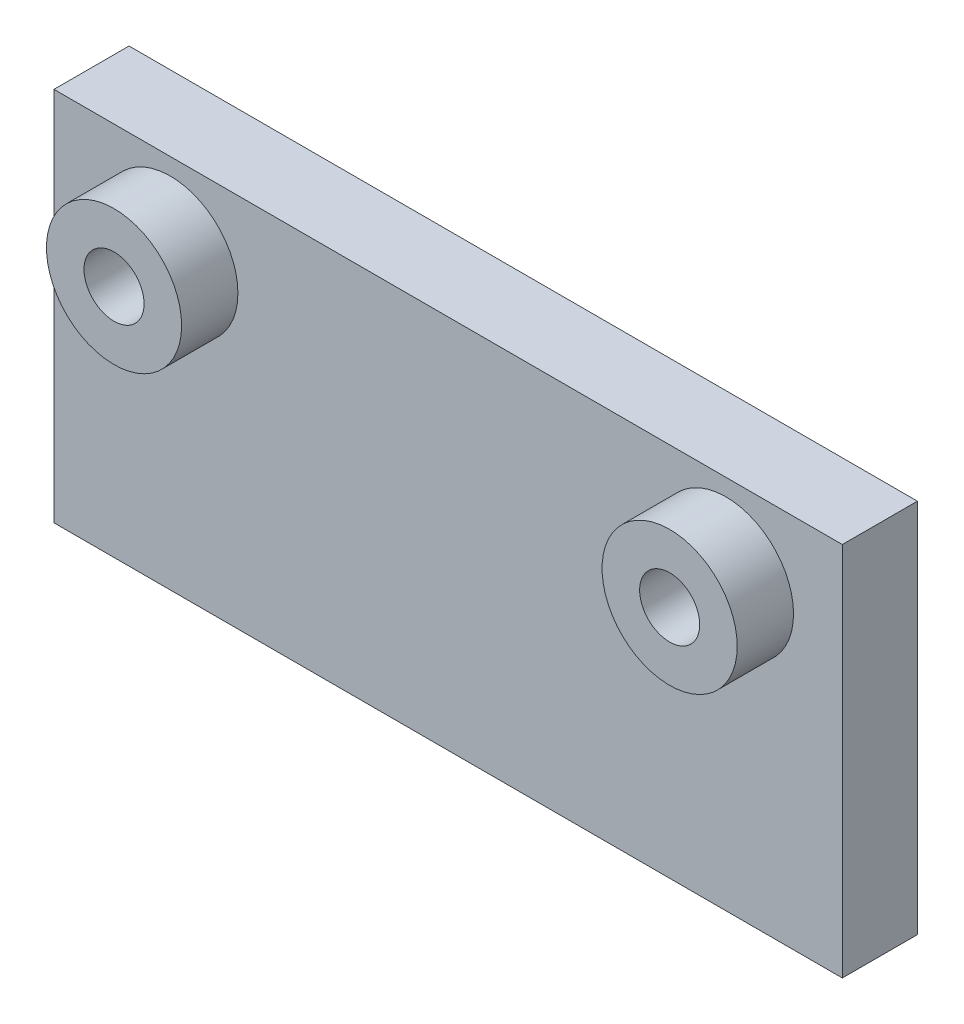
from build123d import *

# Parameters (mm, degrees)
SKETCH_1_W          = 42
SKETCH_1_H          = 20
SKETCH_1_R          = 3.6
EXTRUDE_1_DEPTH     = 4
SKETCH_1_3_R        = 3.6
SKETCH_1_3_R_2      = 1.6
EXTRUDE_2_DEPTH     = 7
CUT_EXTRUDE_3_DEPTH = 2.6
SKETCH_7_W          = 17
SKETCH_7_H          = 5
EXTRUDE_4_DEPTH     = 8
SKETCH_8_R          = 1.6
CUT_EXTRUDE_4_DEPTH = 6.6
CUT_EXTRUDE_5_DEPTH = 2.6


with BuildPart() as part:
    # 草图1 → 凸台-拉伸1 (new body)
    with BuildSketch(Plane.XY):
        with Locations((0, 5)):
            Rectangle(SKETCH_1_W, SKETCH_1_H)
        with Locations((14.8, 10.5)):
            Circle(SKETCH_1_R, mode=Mode.SUBTRACT)
        with Locations((-14.8, 10.5)):
            Circle(SKETCH_1_R, mode=Mode.SUBTRACT)
    extrude(amount=EXTRUDE_1_DEPTH)

    # 草图1<3> → 凸台-拉伸2 (add)
    # profile 1 of 2: a face of its own
    with BuildSketch(Plane.XY):
        with Locations((-14.8, 10.5)):
            Circle(SKETCH_1_3_R)
        with Locations((-14.8, 10.5)):
            Circle(SKETCH_1_3_R_2, mode=Mode.SUBTRACT)
    # profile 2 of 2: a face of its own
    with BuildSketch(Plane.XY):
        with Locations((14.8, 10.5)):
            Circle(SKETCH_1_3_R)
        with Locations((14.8, 10.5)):
            Circle(SKETCH_1_3_R_2, mode=Mode.SUBTRACT)
    extrude(amount=EXTRUDE_2_DEPTH)

    # 草图6 → 切除-拉伸3 (cut)
    with BuildSketch(Plane(origin=(0, 0, 0), x_dir=(-1, 0, 0), z_dir=(0, 0, -1))):
        Polygon((-11.624573519, 10.5), (-13.21228676, 13.25), (-16.38771324, 13.25), (-17.975426481, 10.5), (-16.38771324, 7.75), (-13.21228676, 7.75), align=None)
        Polygon((17.975426481, 10.5), (16.38771324, 13.25), (13.21228676, 13.25), (11.624573519, 10.5), (13.21228676, 7.75), (16.38771324, 7.75), align=None)
    extrude(amount=-CUT_EXTRUDE_3_DEPTH, mode=Mode.SUBTRACT)

    # 草图7 → 凸台-拉伸4 (add)
    with BuildSketch(Plane(origin=(0, 0, 0), x_dir=(-1, 0, 0), z_dir=(0, 0, -1))):
        with Locations((0, -2.5)):
            Rectangle(SKETCH_7_W, SKETCH_7_H)
    extrude(amount=EXTRUDE_4_DEPTH)

    # 草图8 → 切除-拉伸4 (cut)
    with BuildSketch(Plane(origin=(0, 0, 0), x_dir=(1, 0, 0), z_dir=(0, 1, 0))):
        with Locations((-5, 4.6)):
            Circle(SKETCH_8_R)
        with Locations((5, 4.6)):
            Circle(SKETCH_8_R)
    extrude(amount=-CUT_EXTRUDE_4_DEPTH, mode=Mode.SUBTRACT)

    # 草图9 → 切除-拉伸5 (cut)
    with BuildSketch(Plane(origin=(0, 0, 0), x_dir=(1, 0, 0), z_dir=(0, 1, 0))):
        Polygon((1.824573519, 4.6), (3.41228676, 1.85), (6.58771324, 1.85), (8.175426481, 4.6), (6.58771324, 7.35), (3.41228676, 7.35), align=None)
        Polygon((-8.175426481, 4.6), (-6.58771324, 1.85), (-3.41228676, 1.85), (-1.824573519, 4.6), (-3.41228676, 7.35), (-6.58771324, 7.35), align=None)
    extrude(amount=-CUT_EXTRUDE_5_DEPTH, mode=Mode.SUBTRACT)


solid = part.part
